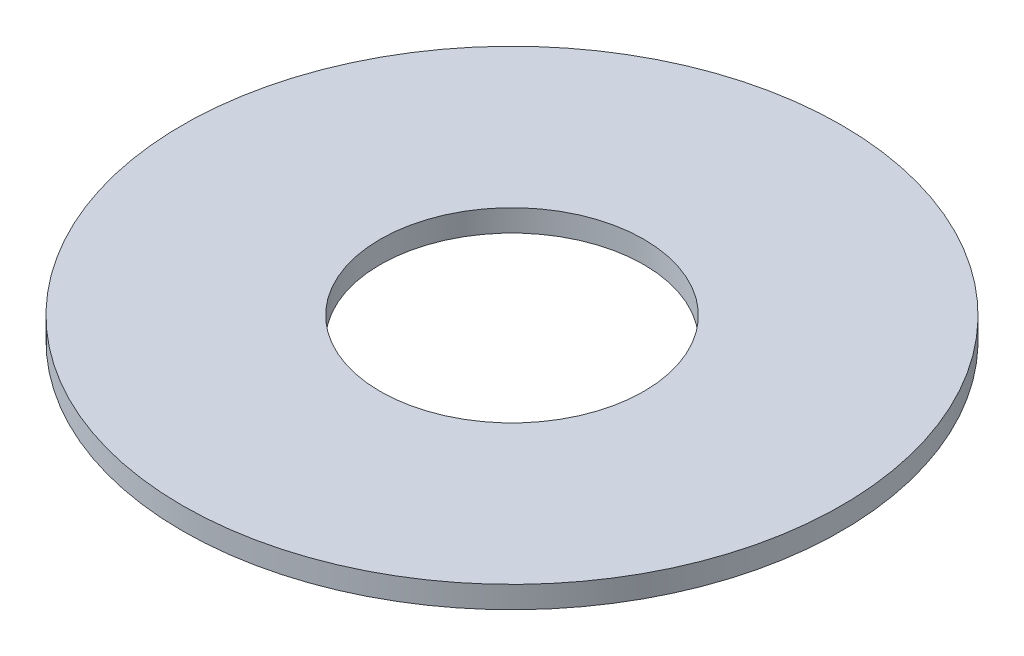
from build123d import *

# Parameters (mm, degrees)
SKETCH1_R           = 19.05
SKETCH1_R_2         = 7.62
BOSS_EXTRUDE1_DEPTH = 1.27


with BuildPart() as part:
    # Sketch1 → Boss-Extrude1 (new body)
    with BuildSketch(Plane(origin=(0, 0, 0), x_dir=(1, 0, 0), z_dir=(0, 1, 0))):
        with Locations(Location((0, 0, 0), (0, 0, 270))):
            Circle(SKETCH1_R)
        with Locations(Location((0, 0, 0), (0, 0, 270))):
            Circle(SKETCH1_R_2, mode=Mode.SUBTRACT)
    extrude(amount=BOSS_EXTRUDE1_DEPTH)


solid = part.part
